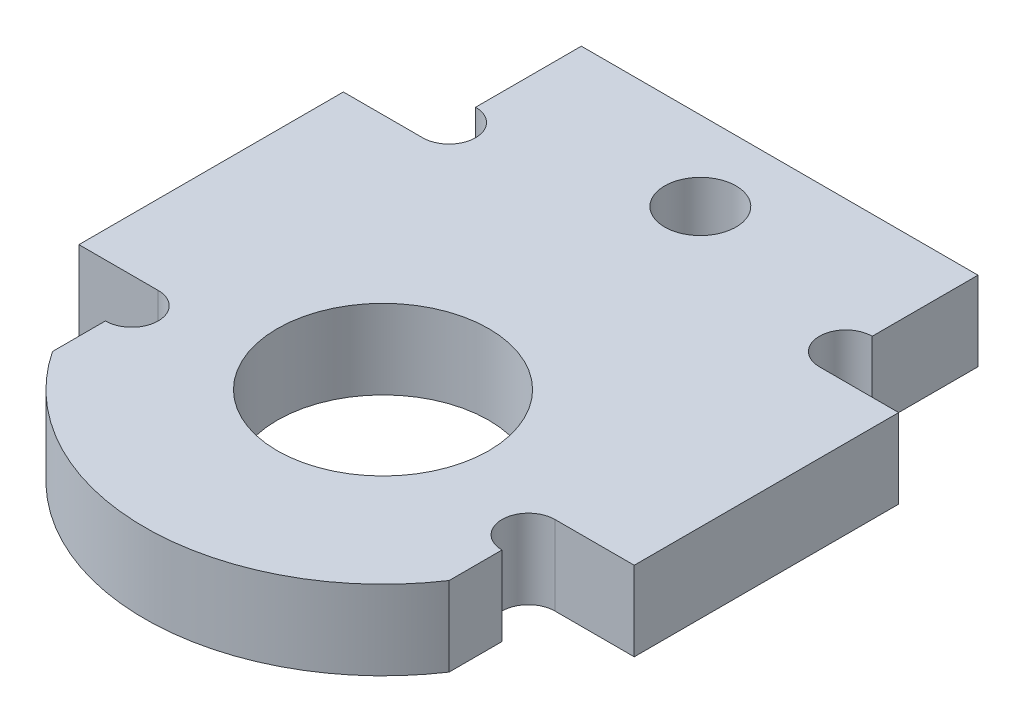
from build123d import *

# Parameters (mm, degrees)
SKETCH_1_R          = 4
EXTRUDE_1_DEPTH     = 3
SKETCH_3_W          = 15
SKETCH_3_H          = 10
EXTRUDE_3_DEPTH     = 3
SKETCH_2_W          = 3
SKETCH_2_H          = 10
EXTRUDE_4_DEPTH     = 3
SKETCH_4_R          = 1
CUT_EXTRUDE_1_DEPTH = 19.553975315
SKETCH_5_R          = 1.35
CUT_EXTRUDE_2_DEPTH = 19.553975315


with BuildPart() as part:
    # 草图1 → 凸台-拉伸1 (new body)
    with BuildSketch(Plane(origin=(0, 0, 0), x_dir=(1, 0, 0), z_dir=(0, 1, 0))):
        with BuildLine():
            Line((-7.5, 0), (-7.5, 5))
            Line((-7.5, 5), (7.5, 5))
            Line((7.5, 5), (7.5, 0))
            Line((7.5, 0), (7.5, -5))
            ThreePointArc((7.5, -5), (0, -9.013878189), (-7.5, -5))
            Line((-7.5, -5), (-7.5, 0))
        make_face()
        with Locations(Location((0, 0, 0), (0, 0, 270))):
            Circle(SKETCH_1_R, mode=Mode.SUBTRACT)
    extrude(amount=EXTRUDE_1_DEPTH)

    # 草图3 → 凸台-拉伸3 (add)
    with BuildSketch(Plane(origin=(0, 3, 0), x_dir=(1, 0, 0), z_dir=(0, 1, 0))):
        with Locations((0, 10)):
            Rectangle(SKETCH_3_W, SKETCH_3_H)
    extrude(amount=-EXTRUDE_3_DEPTH)

    # 草图2 → 凸台-拉伸4 (add)
    with BuildSketch(Plane(origin=(0, 3, 0), x_dir=(1, 0, 0), z_dir=(0, 1, 0))):
        with Locations((9, 4)):
            Rectangle(SKETCH_2_W, SKETCH_2_H)
        with Locations((-9, 4)):
            Rectangle(SKETCH_2_W, SKETCH_2_H)
    extrude(amount=-EXTRUDE_4_DEPTH)

    # 草图4 → 切除-拉伸1 (cut, through all)
    with BuildSketch(Plane.XZ):
        with Locations((7.5, -10)):
            Circle(SKETCH_4_R)
        with Locations((7.5, 2)):
            Circle(SKETCH_4_R)
        with Locations((-7.5, 2)):
            Circle(SKETCH_4_R)
        with Locations((-7.5, -10)):
            Circle(SKETCH_4_R)
    extrude(amount=-CUT_EXTRUDE_1_DEPTH, mode=Mode.SUBTRACT)

    # 草图5 → 切除-拉伸2 (cut, through all)
    with BuildSketch(Plane.XZ):
        with Locations(Location((0, -12, 0), (0, 0, 270))):
            Circle(SKETCH_5_R)
    extrude(amount=-CUT_EXTRUDE_2_DEPTH, mode=Mode.SUBTRACT)


solid = part.part
